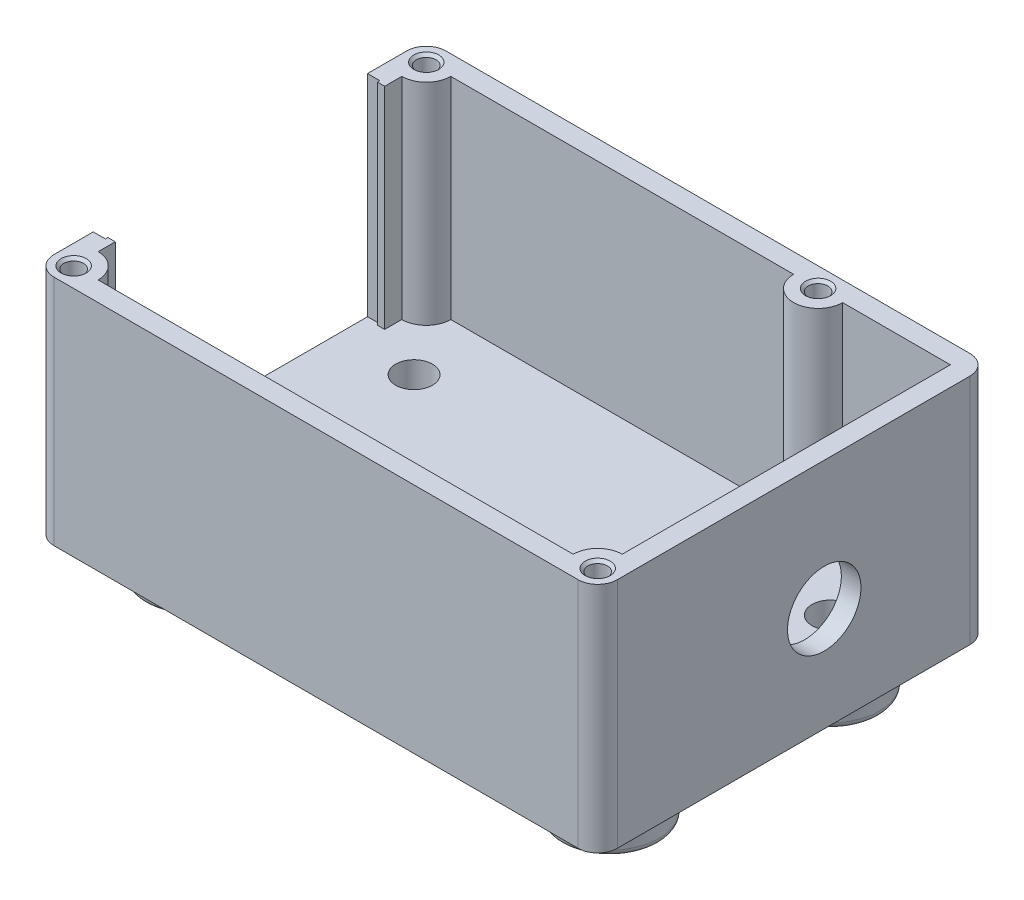
from build123d import *

# Parameters (mm, degrees)
SKETCH1_W                       = 46
SKETCH1_H                       = 32
BOSS_EXTRUDE1_DEPTH             = 19
M2X0_4_TAPPED_HOLE1_D           = 1.6
M2X0_4_TAPPED_HOLE1_DEPTH       = 6
M2X0_4_TAPPED_HOLE1_CSINK_D     = 2.05
M2X0_4_TAPPED_HOLE1_CSINK_ANGLE = 90
M2X0_4_TAPPED_HOLE1_TIP         = 0.480688495
FILLET1_R                       = 1.6
CUT_EXTRUDE3_DEPTH              = 17.2
SKETCH6_W                       = 2
SKETCH6_H                       = 22
CUT_EXTRUDE1_DEPTH              = 17.2
SKETCH7_W                       = 1
SKETCH7_H                       = 22.4
CUT_EXTRUDE2_DEPTH              = 17.2
SKETCH9_R                       = 3
CUT_EXTRUDE4_DEPTH              = 53.27810249
SKETCH10_R                      = 1.5
CUT_EXTRUDE5_DEPTH              = 10
BOSS_EXTRUDE5_START             = 3.5
SKETCH12_R                      = 4
SKETCH12_R_2                    = 1.5
BOSS_EXTRUDE5_DEPTH             = 3.5
FILLET4_R                       = 0.5


with BuildPart() as part:
    # Sketch1 → Boss-Extrude1 (new body)
    with BuildSketch(Plane(origin=(0, 0, 0), x_dir=(1, 0, 0), z_dir=(0, 1, 0))):
        with Locations((9, 0)):
            Rectangle(SKETCH1_W, SKETCH1_H)
    extrude(amount=-BOSS_EXTRUDE1_DEPTH)

    # M2x0.4 Tapped Hole1
    with Locations(Plane(origin=(0, 0, 0), x_dir=(1, 0, 0), z_dir=(0, 1, 0))):
        with Locations((-12.4, 14.4), (19.6, 14.4), (30.4, -14.4), (-12.4, -14.4)):
            CounterSinkHole(M2X0_4_TAPPED_HOLE1_D / 2, M2X0_4_TAPPED_HOLE1_CSINK_D / 2, depth=M2X0_4_TAPPED_HOLE1_DEPTH, counter_sink_angle=M2X0_4_TAPPED_HOLE1_CSINK_ANGLE)
            with Locations((0, 0, -(M2X0_4_TAPPED_HOLE1_DEPTH + M2X0_4_TAPPED_HOLE1_TIP / 2))):  # 118° drill point
                Cone(0, M2X0_4_TAPPED_HOLE1_D / 2, M2X0_4_TAPPED_HOLE1_TIP, mode=Mode.SUBTRACT)

    # Fillet1
    fillet1_edges = [part.edges().sort_by_distance(p)[0] for p in [
        (-14, -9.5, -16),
        (32, -9.5, -16),
        (32, -9.5, 16),
        (-14, -9.5, 16),
    ]]
    fillet(fillet1_edges, radius=FILLET1_R)

    # Sketch8 → Cut-Extrude3 (cut)
    with BuildSketch(Plane(origin=(0, 0, 0), x_dir=(1, 0, 0), z_dir=(0, 1, 0))):
        with BuildLine():
            Line((-10.4, 14.4), (17.6, 14.4))
            ThreePointArc((17.6, 14.4), (19.6, 12.4), (21.6, 14.4))
            Line((21.6, 14.4), (30.4, 14.4))
            Line((30.4, 14.4), (30.4, -12.4))
            ThreePointArc((30.4, -12.4), (28.985786438, -12.985786438), (28.4, -14.4))
            Line((28.4, -14.4), (-10.4, -14.4))
            ThreePointArc((-10.4, -14.4), (-10.985786438, -12.985786438), (-12.4, -12.4))
            Line((-12.4, -12.4), (-12.4, 12.4))
            ThreePointArc((-12.4, 12.4), (-10.985786438, 12.985786438), (-10.4, 14.4))
        make_face()
    extrude(amount=-CUT_EXTRUDE3_DEPTH, mode=Mode.SUBTRACT)

    # Sketch6 → Cut-Extrude1 (cut)
    with BuildSketch(Plane(origin=(0, 0, 0), x_dir=(1, 0, 0), z_dir=(0, 1, 0))):
        with Locations((-13, 0)):
            Rectangle(SKETCH6_W, SKETCH6_H)
    extrude(amount=-CUT_EXTRUDE1_DEPTH, mode=Mode.SUBTRACT)

    # Sketch7 → Cut-Extrude2 (cut)
    with BuildSketch(Plane(origin=(0, 0, 0), x_dir=(1, 0, 0), z_dir=(0, 1, 0))):
        with Locations((-13.5, 0)):
            Rectangle(SKETCH7_W, SKETCH7_H)
    extrude(amount=-CUT_EXTRUDE2_DEPTH, mode=Mode.SUBTRACT)

    # Sketch9 → Cut-Extrude4 (cut, through all)
    with BuildSketch(Plane(origin=(32, 0, 0), x_dir=(0, 0, -1), z_dir=(1, 0, 0))):
        with Locations((2.5, -10.5)):
            Circle(SKETCH9_R)
    extrude(amount=-CUT_EXTRUDE4_DEPTH, mode=Mode.SUBTRACT)

    # Sketch10 → Cut-Extrude5 (cut)
    with BuildSketch(Plane.XZ.offset(19)):
        with Locations(Location((26, 9, 0), (0, 0, 270))):
            Circle(SKETCH10_R)
        with Locations(Location((26, -9, 0), (0, 0, 90))):
            Circle(SKETCH10_R)
        with Locations(Location((-8, -9, 0), (0, 0, 270))):
            Circle(SKETCH10_R)
        with Locations(Location((-8, 9, 0), (0, 0, 90))):
            Circle(SKETCH10_R)
    extrude(amount=-CUT_EXTRUDE5_DEPTH, mode=Mode.SUBTRACT)

    # Sketch12 → Boss-Extrude5 (add)
    # profile 1 of 4: a face of its own
    with BuildSketch(Plane.XZ.offset(19).offset(BOSS_EXTRUDE5_START)):
        with Locations(Location((-8, 9, 0), (0, 0, 90))):
            Circle(SKETCH12_R)
        with Locations(Location((-8, 9, 0), (0, 0, 270))):
            Circle(SKETCH12_R_2, mode=Mode.SUBTRACT)
    # profile 2 of 4: a face of its own
    with BuildSketch(Plane.XZ.offset(19).offset(BOSS_EXTRUDE5_START)):
        with Locations(Location((26, 9, 0), (0, 0, 90))):
            Circle(SKETCH12_R)
        with Locations(Location((26, 9, 0), (0, 0, 90))):
            Circle(SKETCH12_R_2, mode=Mode.SUBTRACT)
    # profile 3 of 4: a face of its own
    with BuildSketch(Plane.XZ.offset(19).offset(BOSS_EXTRUDE5_START)):
        with Locations(Location((26, -9, 0), (0, 0, 90))):
            Circle(SKETCH12_R)
        with Locations(Location((26, -9, 0), (0, 0, 270))):
            Circle(SKETCH12_R_2, mode=Mode.SUBTRACT)
    # profile 4 of 4: a face of its own
    with BuildSketch(Plane.XZ.offset(19).offset(BOSS_EXTRUDE5_START)):
        with Locations(Location((-8, -9, 0), (0, 0, 90))):
            Circle(SKETCH12_R)
        with Locations(Location((-8, -9, 0), (0, 0, 90))):
            Circle(SKETCH12_R_2, mode=Mode.SUBTRACT)
    extrude(amount=-BOSS_EXTRUDE5_DEPTH)

    # Fillet4
    fillet4_edges = [part.edges().sort_by_distance(p)[0] for p in [
        (-8, -22.5, 5),
        (26, -22.5, 5),
        (26, -22.5, -13),
        (-8, -22.5, -13),
    ]]
    fillet(fillet4_edges, radius=FILLET4_R)


solid = part.part
